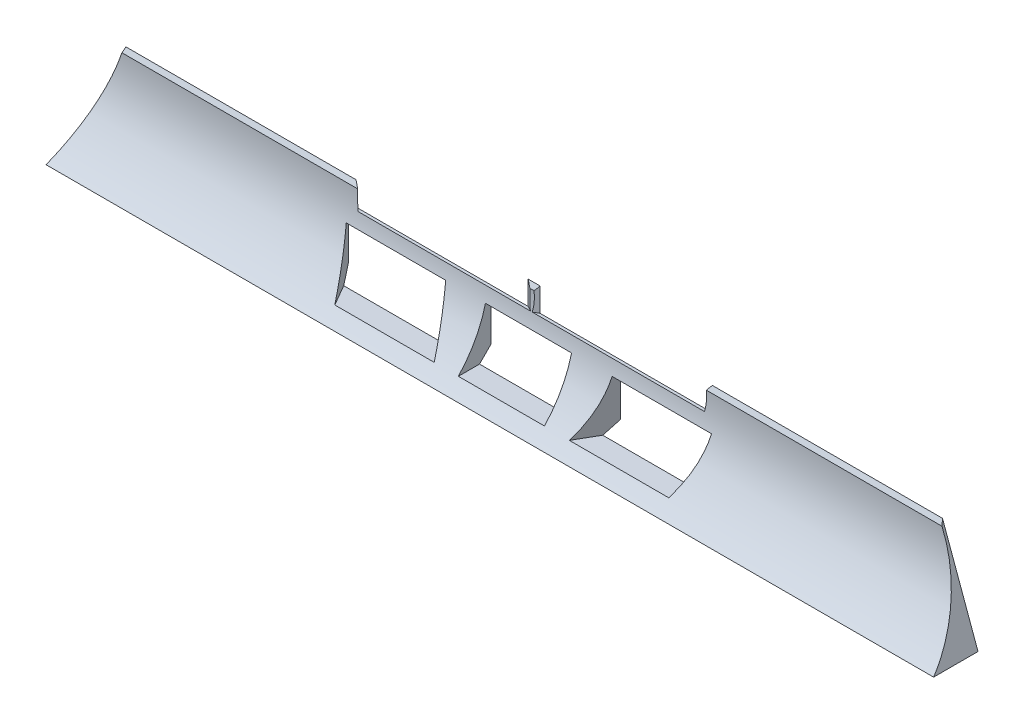
from build123d import *

# Parameters (mm, degrees)
BOSS_EXTRUDE1_DEPTH = 200
CUT_EXTRUDE1_DEPTH  = 202.45470955
CUT_EXTRUDE2_DEPTH  = 202.45470955
BOSS_EXTRUDE2_REACH = 203.455
SKETCH5_W           = 3
SKETCH5_H           = 5
CUT_EXTRUDE3_DEPTH  = 202.45470955
CUT_EXTRUDE4_DEPTH  = 1.8
SKETCH9_W           = 19.4
SKETCH9_H           = 11.2
SKETCH9_W_2         = 15.4
SKETCH9_H_2         = 7.2
CUT_EXTRUDE6_DEPTH  = 202.45470955
CUT_EXTRUDE8_START  = -6.8
SKETCH10_W          = 19.4
SKETCH10_H          = 11.2
SKETCH10_W_2        = 15.4
SKETCH10_H_2        = 7.2
CUT_EXTRUDE8_DEPTH  = 22.6
SKETCH11_W          = 19.4
SKETCH11_H          = 12.8
SKETCH11_W_2        = 15.4
SKETCH11_H_2        = 8.8
CUT_EXTRUDE9_DEPTH  = 97.8


with BuildPart() as part:
    # Sketch1 → Boss-Extrude1 (new body)
    with BuildSketch(Plane(origin=(0, 0, 0), x_dir=(0, 0, -1), z_dir=(1, 0, 0))):
        Polygon((0, 0), (-10, 0), (0, 22), align=None)
    extrude(amount=BOSS_EXTRUDE1_DEPTH)

    # Sketch2 → Cut-Extrude1 (cut, through all)
    with BuildSketch(Plane(origin=(200, 0, 0), x_dir=(0, 0, -1), z_dir=(1, 0, 0))):
        with BuildLine():
            Line((-10, 0), (-0.5, 20.9))
            ThreePointArc((-0.5, 20.9), (-2.709071222, 9.295032374), (-10, 0))
        make_face()
    extrude(amount=-CUT_EXTRUDE1_DEPTH, mode=Mode.SUBTRACT)

    # Sketch4 → Cut-Extrude2 (cut, through all)
    with BuildSketch(Plane(origin=(200, 0, 0), x_dir=(0, 0, -1), z_dir=(1, 0, 0))):
        Polygon((-5, 0), (0, 5), (0, 0), align=None)
    extrude(amount=-CUT_EXTRUDE2_DEPTH, mode=Mode.SUBTRACT)

    # Boss-Extrude2: up to this face of the body (flat: up to its plane)
    boss_extrude2_end = Plane(part.part.faces().sort_by_distance((100, 2.5, 2.5))[0])
    # Sketch5 → Boss-Extrude2 (add, up to the picked face)
    with BuildSketch(Plane(origin=(0, 0, 0), x_dir=(-1, 0, 0), z_dir=(0, 0, -1)), mode=Mode.PRIVATE) as boss_extrude2_sk1:
        with Locations((-198.5, 2.5)):
            Rectangle(SKETCH5_W, SKETCH5_H)
    boss_extrude2_tool1 = split(extrude(boss_extrude2_sk1.sketch, amount=-BOSS_EXTRUDE2_REACH, mode=Mode.PRIVATE), bisect_by=boss_extrude2_end, keep=Keep.BOTH, mode=Mode.PRIVATE)
    boss_extrude2 = boss_extrude2_tool1.solids().sort_by(Axis((198.5, 2.5, 0), (0, 0, 1)))[0]
    add(boss_extrude2)

    # Sketch6 → Cut-Extrude3 (cut, through all)
    with BuildSketch(Plane(origin=(0, 0, 0), x_dir=(-1, 0, 0), z_dir=(0, 0, -1))):
        Polygon((-200, 22), (-191.992654846, 22), (-200, 0), align=None)
    cut_extrude3 = extrude(amount=-CUT_EXTRUDE3_DEPTH, mode=Mode.SUBTRACT)

    # Mirror2: Boss-Extrude2, Cut-Extrude3 across plane
    add(boss_extrude2.mirror(Plane(origin=(100, 0, 0), x_dir=(0, 0, 1), z_dir=(1, 0, 0))))
    add(cut_extrude3.mirror(Plane(origin=(100, 0, 0), x_dir=(0, 0, 1), z_dir=(1, 0, 0))), mode=Mode.SUBTRACT)

    # Sketch8 → Cut-Extrude4 (cut)
    with BuildSketch(Plane(origin=(0, 0, 0), x_dir=(-1, 0, 0), z_dir=(0, 0, -1))):
        Polygon((-165.621385956, 11.1), (-167.411171791, 8), (-165.621385956, 4.9), (-162.041814288, 4.9), (-160.252028453, 8), (-162.041814288, 11.1), align=None)
    cut_extrude4 = extrude(amount=-CUT_EXTRUDE4_DEPTH, mode=Mode.SUBTRACT)

    # Sketch9 → Cut-Extrude6 (cut, through all)
    with BuildSketch(Plane.XY):
        with Locations((99.915800061, 8.065)):
            Rectangle(SKETCH9_W, SKETCH9_H)
        with Locations((99.915800061, 8.065)):
            Rectangle(SKETCH9_W_2, SKETCH9_H_2, mode=Mode.SUBTRACT)
    extrude(amount=CUT_EXTRUDE6_DEPTH, mode=Mode.SUBTRACT)


with BuildPart() as cut_extrude6_kept_piece:
    # of the separate pieces the step leaves, the one the design keeps (cut_extrude6_pieces_kept)
    add(part.part.solids().sort_by_distance((197, 5, 0))[0])

    # Sketch10 → Cut-Extrude8 (cut)
    # profile 1 of 2: a face of its own
    with BuildSketch(Plane(origin=(32.136000823, 0, -55.661186177), x_dir=(0.866025403784433, 0, 0.5000000000000099), z_dir=(-0.5000000000000098, 0, 0.8660254037844329)).offset(CUT_EXTRUDE8_START)):
        with Locations((113.139032853, 8.065)):
            Rectangle(SKETCH10_W, SKETCH10_H)
        with Locations((113.139032853, 8.065)):
            Rectangle(SKETCH10_W_2, SKETCH10_H_2, mode=Mode.SUBTRACT)
    # profile 2 of 2: a face of its own
    with BuildSketch(Plane(origin=(32.136000823, 0, -55.661186177), x_dir=(0.866025403784433, 0, 0.5000000000000099), z_dir=(-0.5000000000000098, 0, 0.8660254037844329)).offset(CUT_EXTRUDE8_START)):
        with Locations((113.139032853, 8.065)):
            Rectangle(SKETCH10_W_2, SKETCH10_H_2)
    cut_extrude8 = extrude(amount=CUT_EXTRUDE8_DEPTH, mode=Mode.SUBTRACT)

    # Sketch11 → Cut-Extrude9 (cut)
    # profile 1 of 2: a face of its own
    with BuildSketch(Plane(origin=(115.669713788, 0, -66.781940393), x_dir=(0.4999999999999981, -1.9080601945838373e-15, 0.8660254037844397), z_dir=(-0.8660254037844397, 3.3048572009189827e-15, 0.4999999999999981))):
        with Locations((60.371690641, 23.065)):
            Rectangle(SKETCH11_W, SKETCH11_H)
        with Locations((60.371690641, 23.065)):
            Rectangle(SKETCH11_W_2, SKETCH11_H_2, mode=Mode.SUBTRACT)
    # profile 2 of 2: a face of its own
    with BuildSketch(Plane(origin=(115.669713788, 0, -66.781940393), x_dir=(0.4999999999999981, -1.9080601945838373e-15, 0.8660254037844397), z_dir=(-0.8660254037844397, 3.3048572009189827e-15, 0.4999999999999981))):
        with Locations((60.371690641, 23.065)):
            Rectangle(SKETCH11_W_2, SKETCH11_H_2)
    cut_extrude9 = extrude(amount=CUT_EXTRUDE9_DEPTH, mode=Mode.SUBTRACT)

    # Mirror4: Cut-Extrude8, Cut-Extrude9 across plane
    add(cut_extrude8.mirror(Plane(origin=(100, 0, 0), x_dir=(0, 0, 1), z_dir=(1, 0, 0))), mode=Mode.SUBTRACT)
    add(cut_extrude9.mirror(Plane(origin=(100, 0, 0), x_dir=(0, 0, 1), z_dir=(1, 0, 0))), mode=Mode.SUBTRACT)

    # Mirror5: Cut-Extrude4 across plane
    add(cut_extrude4.mirror(Plane(origin=(100, 0, 0), x_dir=(0, 0, 1), z_dir=(1, 0, 0))), mode=Mode.SUBTRACT)


solid = cut_extrude6_kept_piece.part
